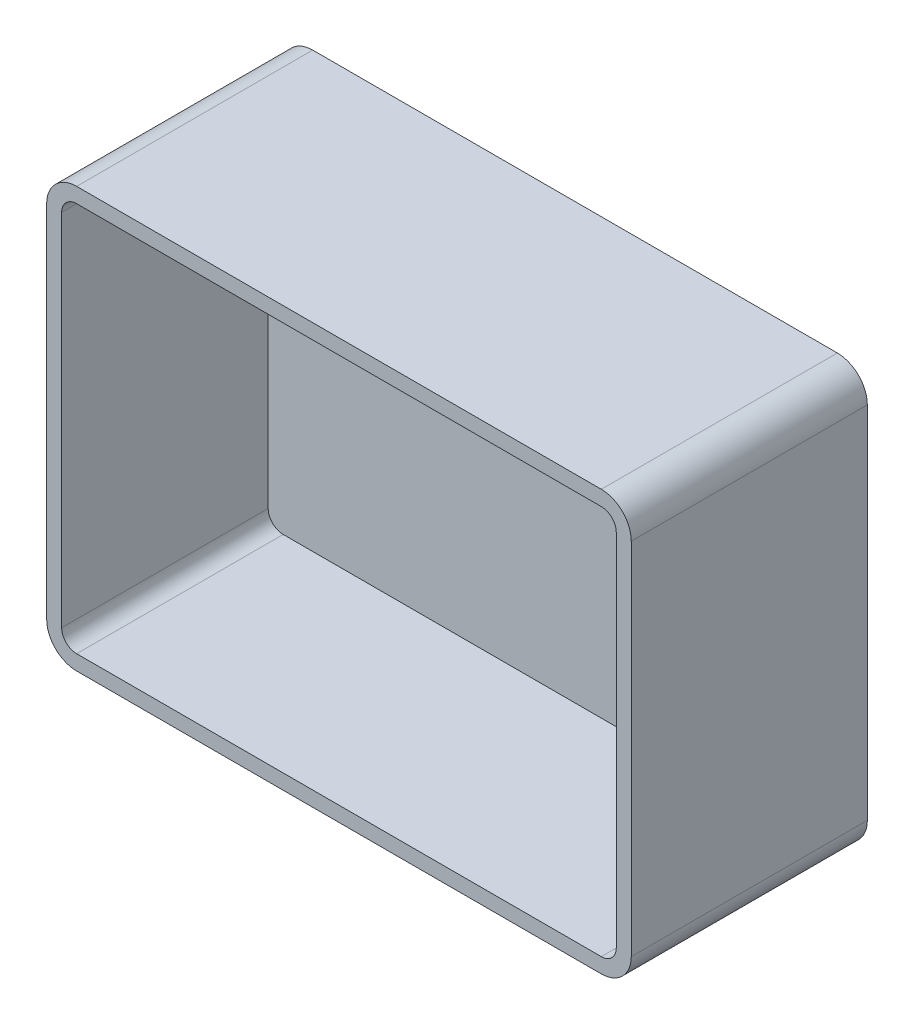
from build123d import *

# Parameters (mm, degrees)
SKETCH1_W           = 99.06
SKETCH1_H           = 71.12
BOSS_EXTRUDE1_DEPTH = 40
FILLET1_R           = 5.08
CUT_EXTRUDE2_DEPTH  = 35


with BuildPart() as part:
    # Sketch1 → Boss-Extrude1 (new body)
    with BuildSketch(Plane.XY):
        with Locations((0.589485294, -0.109632353)):
            Rectangle(SKETCH1_W, SKETCH1_H)
    extrude(amount=BOSS_EXTRUDE1_DEPTH)

    # Fillet1
    fillet1_edges = [part.edges().sort_by_distance(p)[0] for p in [
        (-48.940514706, 35.450367647, 20),
        (50.119485294, 35.450367647, 20),
        (50.119485294, -35.669632353, 20),
        (-48.940514706, -35.669632353, 20),
    ]]
    fillet(fillet1_edges, radius=FILLET1_R)

    # Sketch2 → Cut-Extrude2 (cut)
    with BuildSketch(Plane.XY.offset(40)):
        with BuildLine():
            Line((47.579485294, -30.589632353), (47.579485294, 30.370367647))
            ThreePointArc((47.579485294, 30.370367647), (46.835536518, 32.166418871), (45.039485294, 32.910367647))
            Line((45.039485294, 32.910367647), (-43.860514706, 32.910367647))
            ThreePointArc((-43.860514706, 32.910367647), (-45.65656593, 32.166418871), (-46.400514706, 30.370367647))
            Line((-46.400514706, 30.370367647), (-46.400514706, -30.589632353))
            ThreePointArc((-46.400514706, -30.589632353), (-45.65656593, -32.385683577), (-43.860514706, -33.129632353))
            Line((-43.860514706, -33.129632353), (45.039485294, -33.129632353))
            ThreePointArc((45.039485294, -33.129632353), (46.835536518, -32.385683577), (47.579485294, -30.589632353))
        make_face()
    extrude(amount=-CUT_EXTRUDE2_DEPTH, mode=Mode.SUBTRACT)


solid = part.part
